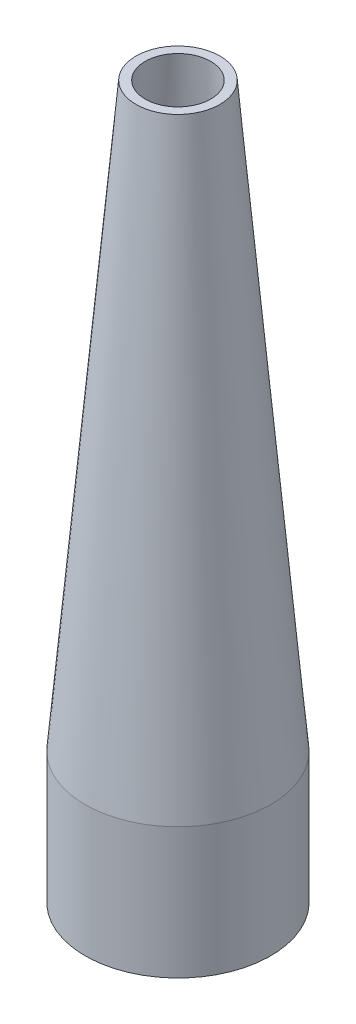
from build123d import *

# Parameters (mm, degrees)
SKETCH1_W = 2.677187507
SKETCH1_H = 38.1


with BuildPart() as part:
    # Sketch1 → Revolve1 (revolve)
    with BuildSketch(Plane.XY, mode=Mode.PRIVATE) as revolve1_sk:
        with Locations((25.648906247, -138.88344348)):
            Rectangle(SKETCH1_W, SKETCH1_H)
        Polygon((24.310312493, -119.83344348), (9.525, 49.163451631), (12.202187507, 49.163451631), (26.9875, -119.83344348), align=None)
    revolve(revolve1_sk.sketch.rotate(Axis((0, 0, 0), (0, 1, 0)), 90), axis=Axis((0, 0, 0), (0, 1, 0)))


solid = part.part
